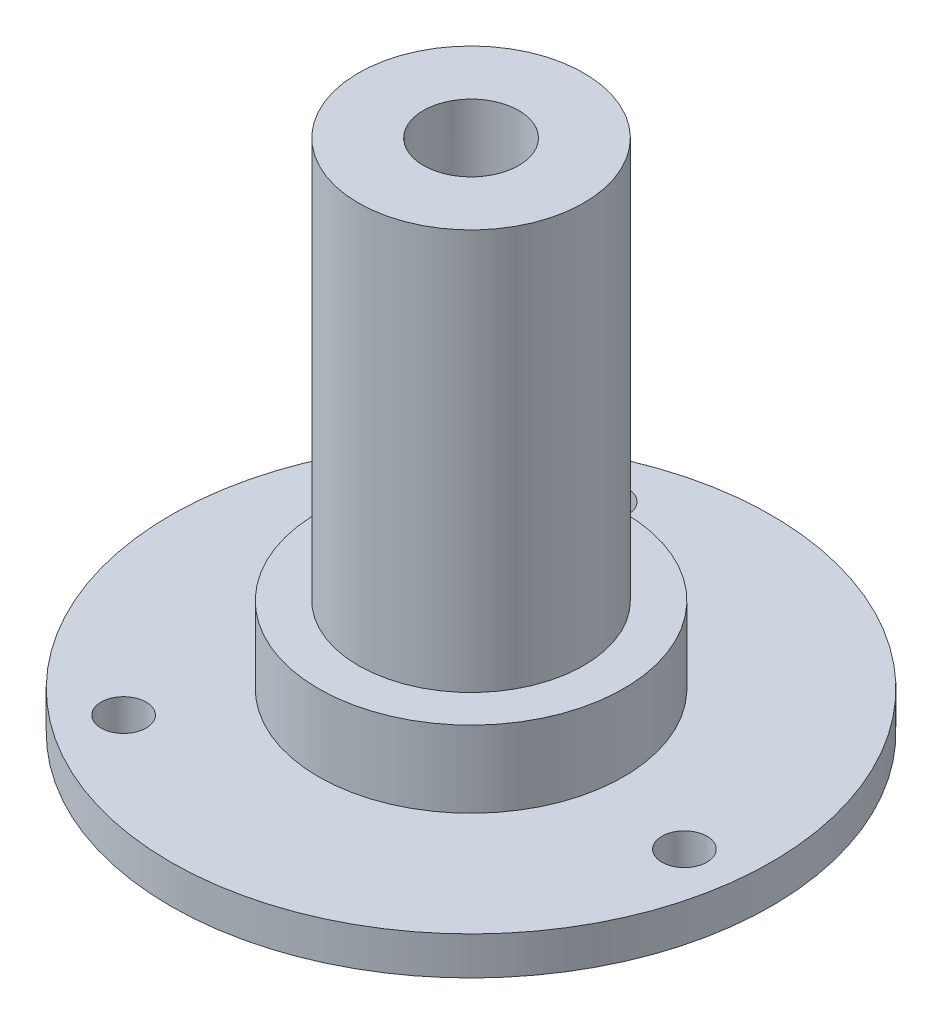
from build123d import *

# Parameters (mm, degrees)
SKETCH1_R           = 20
BOSS_EXTRUDE1_DEPTH = 2.54
SKETCH2_R           = 7.499999986
BOSS_EXTRUDE2_DEPTH = 31.75
SKETCH6_R           = 1.5
CUT_EXTRUDE2_DEPTH  = 45.450017998
SKETCH7_R           = 3.175
CUT_EXTRUDE3_DEPTH  = 45.450017998
SKETCH8_R           = 1.397
CUT_EXTRUDE4_DEPTH  = 45.450017998
SKETCH9_R           = 1.397
CUT_EXTRUDE5_DEPTH  = 45.450018075
SKETCH10_R          = 10.16
BOSS_EXTRUDE3_DEPTH = 5.08


with BuildPart() as part:
    # Sketch1 → Boss-Extrude1 (new body)
    with BuildSketch(Plane(origin=(0, 0, 0), x_dir=(1, 0, 0), z_dir=(0, 1, 0))):
        with Locations(Location((0, 0, 0), (0, 0, 270))):
            Circle(SKETCH1_R)
    extrude(amount=BOSS_EXTRUDE1_DEPTH)

    # Sketch2 → Boss-Extrude2 (add)
    with BuildSketch(Plane(origin=(0, 2.54, 0), x_dir=(1, 0, 0), z_dir=(0, 1, 0))):
        with Locations(Location((0, 0, 0), (0, 0, 270))):
            Circle(SKETCH2_R)
    extrude(amount=BOSS_EXTRUDE2_DEPTH)

    # Sketch6 → Cut-Extrude2 (cut, through all)
    with BuildSketch(Plane(origin=(0, 0, 0), x_dir=(-1, 0, 0), z_dir=(0, -1, 0))):
        with Locations(Location((6.313805851, 15.242875716, 0), (0, 0, 90))):
            Circle(SKETCH6_R)
        with Locations(Location((10.043814672, -13.08935412, 0), (0, 0, 90))):
            Circle(SKETCH6_R)
        with Locations(Location((-16.357620523, -2.153521596, 0), (0, 0, 90))):
            Circle(SKETCH6_R)
    extrude(amount=-CUT_EXTRUDE2_DEPTH, mode=Mode.SUBTRACT)

    # Sketch7 → Cut-Extrude3 (cut, through all)
    with BuildSketch(Plane(origin=(0, 34.29, 0), x_dir=(1, 0, 0), z_dir=(0, 1, 0))):
        with Locations(Location((0, 0, 0), (0, 0, 270))):
            Circle(SKETCH7_R)
    extrude(amount=-CUT_EXTRUDE3_DEPTH, mode=Mode.SUBTRACT)

    # Sketch8 → Cut-Extrude4 (cut, through all)
    with BuildSketch(Plane(origin=(0, 0, 0), x_dir=(0, 0, -1), z_dir=(1, 0, 0))):
        with Locations((0, 22.29)):
            Circle(SKETCH8_R)
    extrude(amount=-CUT_EXTRUDE4_DEPTH, mode=Mode.SUBTRACT)

    # Sketch9 → Cut-Extrude5 (cut, through all)
    with BuildSketch(Plane.XY):
        with Locations((0, 27.29)):
            Circle(SKETCH9_R)
    extrude(amount=-CUT_EXTRUDE5_DEPTH, mode=Mode.SUBTRACT)

    # Sketch10 → Boss-Extrude3 (add)
    with BuildSketch(Plane(origin=(0, 2.54, 0), x_dir=(1, 0, 0), z_dir=(0, 1, 0))):
        with Locations(Location((0, 0, 0), (0, 0, 270))):
            Circle(SKETCH10_R)
    extrude(amount=BOSS_EXTRUDE3_DEPTH)


solid = part.part
